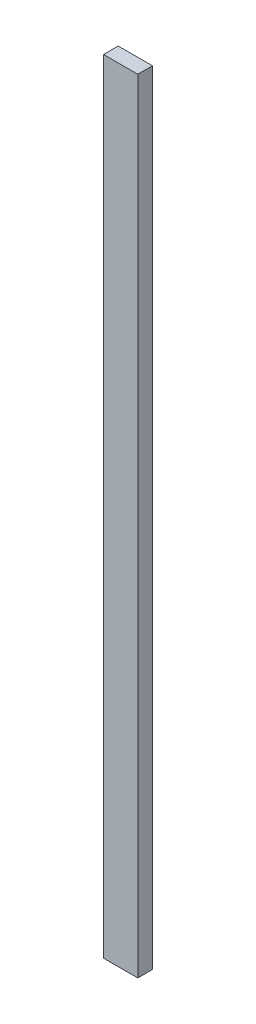
from build123d import *

# Parameters (mm, degrees)
SKETCH1_W           = 88.9
SKETCH1_H           = 38.1
BOSS_EXTRUDE1_DEPTH = 2032


with BuildPart() as part:
    # Sketch1 → Boss-Extrude1 (new body)
    with BuildSketch(Plane(origin=(0, 0, 0), x_dir=(1, 0, 0), z_dir=(0, 1, 0))):
        Rectangle(SKETCH1_W, SKETCH1_H)
    extrude(amount=BOSS_EXTRUDE1_DEPTH)


solid = part.part
